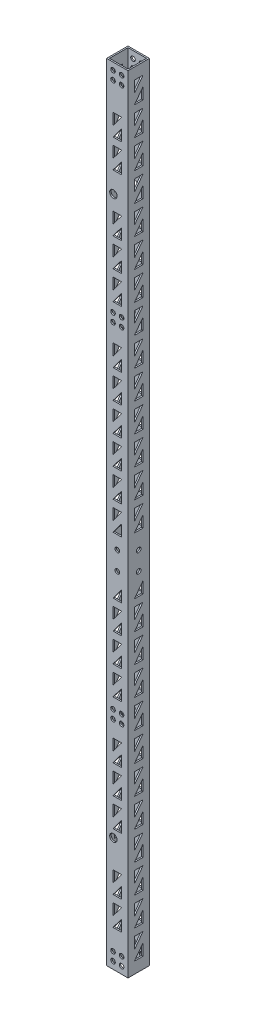
from build123d import *

# Parameters (mm, degrees)
SKETCH_1_W          = 15
SKETCH_1_H          = 15
SKETCH_1_W_2        = 13
SKETCH_1_H_2        = 13
EXTRUDE_1_DEPTH     = 551
SKETCH_2_R          = 1.6
SKETCH_2_R_2        = 2.6
CUT_EXTRUDE_1_DEPTH = 15
SKETCH_4_R          = 1.6
CUT_EXTRUDE_2_DEPTH = 15


with BuildPart() as part:
    # 草图1 → 凸台-拉伸1 (new body)
    with BuildSketch(Plane(origin=(0, 0, 0), x_dir=(1, 0, 0), z_dir=(0, 1, 0))):
        Rectangle(SKETCH_1_W, SKETCH_1_H)
        Rectangle(SKETCH_1_W_2, SKETCH_1_H_2, mode=Mode.SUBTRACT)
    extrude(amount=EXTRUDE_1_DEPTH)

    # 草图2 → 切除-拉伸1 (cut)
    with BuildSketch(Plane.XY.offset(7.5)):
        with Locations((-3, 546)):
            Circle(SKETCH_2_R)
        with Locations((3, 546)):
            Circle(SKETCH_2_R)
        with Locations((-3, 540)):
            Circle(SKETCH_2_R)
        with Locations((3, 540)):
            Circle(SKETCH_2_R)
        with Locations((3, 11)):
            Circle(SKETCH_2_R)
        with Locations((-3, 11)):
            Circle(SKETCH_2_R)
        with Locations((3, 5)):
            Circle(SKETCH_2_R)
        with Locations((-3, 5)):
            Circle(SKETCH_2_R)
        with Locations((0, 256.2)):
            Circle(SKETCH_2_R)
        with Locations((0, 243.2)):
            Circle(SKETCH_2_R)
        with Locations((-2.75, 471)):
            Circle(SKETCH_2_R_2)
        with Locations((-2.75, 80)):
            Circle(SKETCH_2_R_2)
        with Locations((-3, 399)):
            Circle(SKETCH_2_R)
        with Locations((-3, 393)):
            Circle(SKETCH_2_R)
        with Locations((3, 393)):
            Circle(SKETCH_2_R)
        with Locations((3, 399)):
            Circle(SKETCH_2_R)
        with Locations((3, 152)):
            Circle(SKETCH_2_R)
        with Locations((3, 158)):
            Circle(SKETCH_2_R)
        with Locations((-3, 158)):
            Circle(SKETCH_2_R)
        with Locations((-3, 152)):
            Circle(SKETCH_2_R)
        Polygon((-3, 512.5), (-3, 520.5), (3, 520.5), align=None)
        Polygon((-3, 505.5), (3, 505.5), (3, 513.5), align=None)
        Polygon((3, 500.5), (-3, 492.5), (-3, 500.5), align=None)
        Polygon((3, 493.5), (-3, 485.5), (3, 485.5), align=None)
        Polygon((3, 460.5), (-3, 452.5), (-3, 460.5), align=None)
        Polygon((3, 453.5), (-3, 445.5), (3, 445.5), align=None)
        Polygon((3, 440.5), (-3, 432.5), (-3, 440.5), align=None)
        Polygon((3, 433.5), (-3, 425.5), (3, 425.5), align=None)
        Polygon((3, 420.5), (-3, 412.5), (-3, 420.5), align=None)
        Polygon((3, 413.5), (-3, 405.5), (3, 405.5), align=None)
        Polygon((3, 380.5), (-3, 372.5), (-3, 380.5), align=None)
        Polygon((3, 373.5), (-3, 365.5), (3, 365.5), align=None)
        Polygon((3, 360.5), (-3, 352.5), (-3, 360.5), align=None)
        Polygon((3, 353.5), (-3, 345.5), (3, 345.5), align=None)
        Polygon((3, 340.5), (-3, 332.5), (-3, 340.5), align=None)
        Polygon((3, 333.5), (-3, 325.5), (3, 325.5), align=None)
        Polygon((3, 320.5), (-3, 312.5), (-3, 320.5), align=None)
        Polygon((3, 313.5), (-3, 305.5), (3, 305.5), align=None)
        Polygon((3, 300.5), (-3, 292.5), (-3, 300.5), align=None)
        Polygon((3, 293.5), (-3, 285.5), (3, 285.5), align=None)
        Polygon((3, 280.5), (-3, 272.5), (-3, 280.5), align=None)
        Polygon((3, 273.5), (-3, 265.5), (3, 265.5), align=None)
        Polygon((3, 233.5), (-3, 225.5), (3, 225.5), align=None)
        Polygon((3, 220.5), (-3, 212.5), (-3, 220.5), align=None)
        Polygon((3, 213.5), (-3, 205.5), (3, 205.5), align=None)
        Polygon((3, 200.5), (-3, 192.5), (-3, 200.5), align=None)
        Polygon((3, 193.5), (-3, 185.5), (3, 185.5), align=None)
        Polygon((3, 180.5), (-3, 172.5), (-3, 180.5), align=None)
        Polygon((3, 173.5), (-3, 165.5), (3, 165.5), align=None)
        Polygon((3, 140.5), (-3, 132.5), (-3, 140.5), align=None)
        Polygon((3, 133.5), (-3, 125.5), (3, 125.5), align=None)
        Polygon((3, 120.5), (-3, 112.5), (-3, 120.5), align=None)
        Polygon((3, 113.5), (-3, 105.5), (3, 105.5), align=None)
        Polygon((3, 100.5), (-3, 92.5), (-3, 100.5), align=None)
        Polygon((3, 93.5), (-3, 85.5), (3, 85.5), align=None)
        Polygon((3, 60.5), (-3, 52.5), (-3, 60.5), align=None)
        Polygon((3, 53.5), (-3, 45.5), (3, 45.5), align=None)
        Polygon((3, 40.5), (-3, 32.5), (-3, 40.5), align=None)
        Polygon((3, 33.5), (-3, 25.5), (3, 25.5), align=None)
    extrude(amount=-CUT_EXTRUDE_1_DEPTH, mode=Mode.SUBTRACT)

    # 草图4 → 切除-拉伸2 (cut)
    with BuildSketch(Plane(origin=(7.5, 0, 0), x_dir=(0, 0, -1), z_dir=(1, 0, 0))):
        with Locations((0, 256.2)):
            Circle(SKETCH_4_R)
        with Locations((0, 243.2)):
            Circle(SKETCH_4_R)
        Polygon((-3, 543), (3, 543), (-3, 535), align=None)
        Polygon((-3, 528), (3, 536), (3, 528), align=None)
        Polygon((-3, 515), (-3, 523), (3, 523), align=None)
        Polygon((3, 508), (-3, 508), (3, 516), align=None)
        Polygon((-3, 495), (-3, 503), (3, 503), align=None)
        Polygon((3, 488), (-3, 488), (3, 496), align=None)
        Polygon((-3, 475), (-3, 483), (3, 483), align=None)
        Polygon((3, 468), (-3, 468), (3, 476), align=None)
        Polygon((-3, 455), (-3, 463), (3, 463), align=None)
        Polygon((3, 448), (-3, 448), (3, 456), align=None)
        Polygon((-3, 435), (-3, 443), (3, 443), align=None)
        Polygon((3, 428), (-3, 428), (3, 436), align=None)
        Polygon((-3, 415), (-3, 423), (3, 423), align=None)
        Polygon((3, 408), (-3, 408), (3, 416), align=None)
        Polygon((-3, 395), (-3, 403), (3, 403), align=None)
        Polygon((3, 388), (-3, 388), (3, 396), align=None)
        Polygon((-3, 375), (-3, 383), (3, 383), align=None)
        Polygon((3, 368), (-3, 368), (3, 376), align=None)
        Polygon((-3, 355), (-3, 363), (3, 363), align=None)
        Polygon((3, 348), (-3, 348), (3, 356), align=None)
        Polygon((-3, 335), (-3, 343), (3, 343), align=None)
        Polygon((3, 328), (-3, 328), (3, 336), align=None)
        Polygon((-3, 315), (-3, 323), (3, 323), align=None)
        Polygon((3, 308), (-3, 308), (3, 316), align=None)
        Polygon((-3, 295), (-3, 303), (3, 303), align=None)
        Polygon((3, 288), (-3, 288), (3, 296), align=None)
        Polygon((-3, 275), (-3, 283), (3, 283), align=None)
        Polygon((3, 268), (-3, 268), (3, 276), align=None)
        Polygon((3, 228), (-3, 228), (3, 236), align=None)
        Polygon((-3, 215), (-3, 223), (3, 223), align=None)
        Polygon((3, 208), (-3, 208), (3, 216), align=None)
        Polygon((-3, 195), (-3, 203), (3, 203), align=None)
        Polygon((3, 188), (-3, 188), (3, 196), align=None)
        Polygon((-3, 175), (-3, 183), (3, 183), align=None)
        Polygon((3, 168), (-3, 168), (3, 176), align=None)
        Polygon((-3, 155), (-3, 163), (3, 163), align=None)
        Polygon((3, 148), (-3, 148), (3, 156), align=None)
        Polygon((-3, 135), (-3, 143), (3, 143), align=None)
        Polygon((3, 128), (-3, 128), (3, 136), align=None)
        Polygon((-3, 115), (-3, 123), (3, 123), align=None)
        Polygon((3, 108), (-3, 108), (3, 116), align=None)
        Polygon((-3, 95), (-3, 103), (3, 103), align=None)
        Polygon((3, 88), (-3, 88), (3, 96), align=None)
        Polygon((-3, 75), (-3, 83), (3, 83), align=None)
        Polygon((3, 68), (-3, 68), (3, 76), align=None)
        Polygon((-3, 55), (-3, 63), (3, 63), align=None)
        Polygon((3, 48), (-3, 48), (3, 56), align=None)
        Polygon((-3, 35), (-3, 43), (3, 43), align=None)
        Polygon((3, 28), (-3, 28), (3, 36), align=None)
        Polygon((-3, 15), (-3, 23), (3, 23), align=None)
        Polygon((3, 8), (-3, 8), (3, 16), align=None)
    extrude(amount=-CUT_EXTRUDE_2_DEPTH, mode=Mode.SUBTRACT)


solid = part.part
